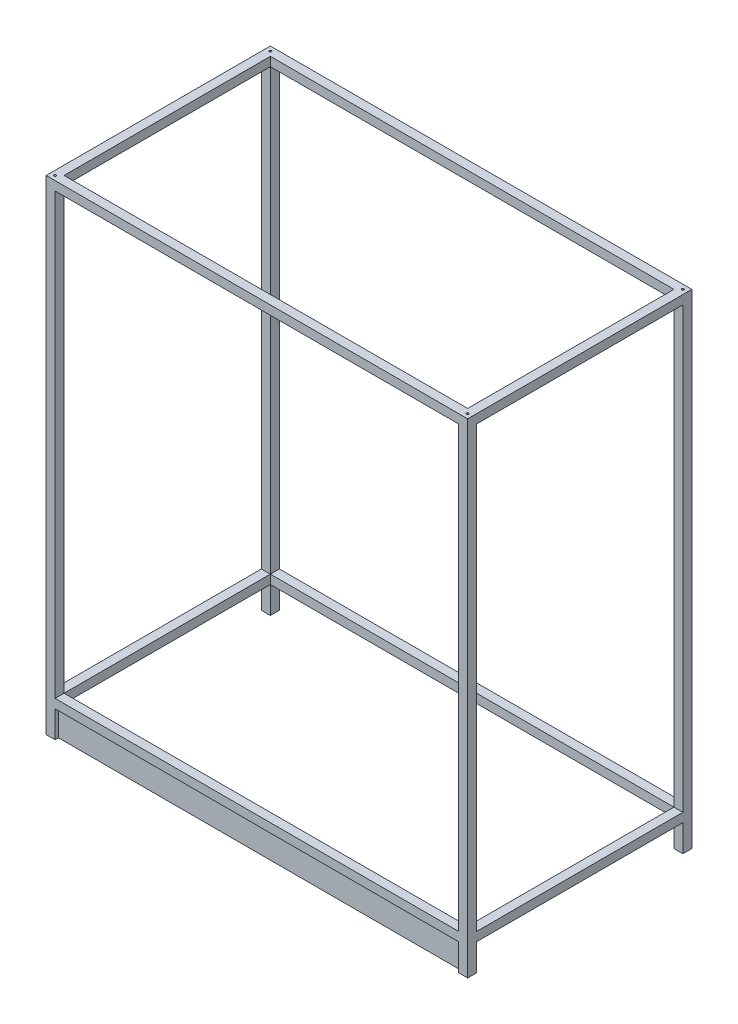
from build123d import *

# Parameters (mm, degrees)
SKETCH1_W       = 1193.8
SKETCH1_H       = 1371.6
EXTRUDE1_DEPTH  = 635
EXTRUDE4_DEPTH  = 1270
SKETCH6_W       = 25.4
SKETCH6_H       = 25.4
EXTRUDE5_DEPTH  = 584.2
SKETCH8_W       = 25.4
SKETCH8_H       = 25.4
EXTRUDE6_DEPTH  = 1143
SKETCH9_W       = 25.4
SKETCH9_H       = 25.4
EXTRUDE7_DEPTH  = 584.2
SKETCH10_W      = 25.4
SKETCH10_H      = 25.4
EXTRUDE8_DEPTH  = 1143
SHELL2_T        = -25.4
SKETCH17_R      = 3.175
EXTRUDE14_DEPTH = 1927.050362789
SKETCH24_W      = 1143
SKETCH24_H      = 584.2
EXTRUDE15_DEPTH = 25.4
SKETCH12_W      = 1143
SKETCH12_H      = 76.2
EXTRUDE16_DEPTH = 38.1
SKETCH13_W      = 584.2
SKETCH13_H      = 76.2
EXTRUDE17_DEPTH = 38.1
SKETCH14_W      = 1143
SKETCH14_H      = 76.2
EXTRUDE18_DEPTH = 38.1
SKETCH11_W      = 584.2
SKETCH11_H      = 76.2
EXTRUDE19_DEPTH = 38.1
SKETCH30_W      = 1143
SKETCH30_H      = 5.614753794
EXTRUDE20_DEPTH = 76.2


with BuildPart() as part:
    # Sketch1 → Extrude1 (new body)
    with BuildSketch(Plane.XY):
        with Locations((596.9, 685.8)):
            Rectangle(SKETCH1_W, SKETCH1_H)
    extrude(amount=EXTRUDE1_DEPTH)

    # Sketch2 → Extrude4 (cut)
    with BuildSketch(Plane(origin=(0, 1371.6, 0), x_dir=(1, 0, 0), z_dir=(0, 1, 0))):
        Polygon((25.4, -609.6), (25.4, -635), (1168.4, -635), (1168.4, -609.6), (1193.8, -609.6), (1193.8, -25.4), (1168.4, -25.4), (1168.4, 0), (25.4, 0), (25.4, -25.4), (0, -25.4), (0, -609.6), align=None)
    extrude(amount=-EXTRUDE4_DEPTH, mode=Mode.SUBTRACT)

    # Sketch6 → Extrude5 (add)
    with BuildSketch(Plane.XY.offset(25.4)):
        with Locations((12.7, 1358.9)):
            Rectangle(SKETCH6_W, SKETCH6_H)
    extrude(amount=EXTRUDE5_DEPTH)

    # Sketch8 → Extrude6 (add)
    with BuildSketch(Plane(origin=(25.4, 0, 0), x_dir=(0, 0, -1), z_dir=(1, 0, 0))):
        with Locations((-622.3, 1358.9)):
            Rectangle(SKETCH8_W, SKETCH8_H)
    extrude(amount=EXTRUDE6_DEPTH)

    # Sketch9 → Extrude7 (add)
    with BuildSketch(Plane(origin=(0, 0, 609.6), x_dir=(-1, 0, 0), z_dir=(0, 0, -1))):
        with Locations((-1181.1, 1358.9)):
            Rectangle(SKETCH9_W, SKETCH9_H)
    extrude(amount=EXTRUDE7_DEPTH)

    # Sketch10 → Extrude8 (add)
    with BuildSketch(Plane.ZY.offset(-1168.4)):
        with Locations((12.7, 1358.9)):
            Rectangle(SKETCH10_W, SKETCH10_H)
    extrude(amount=EXTRUDE8_DEPTH)

    # Shell2
    shell2_openings = [part.faces().sort_by_distance(p)[0] for p in [
        (596.9, 0, 317.5),
    ]]
    offset(amount=SHELL2_T, openings=shell2_openings)

    # Sketch17 → Extrude14 (cut, through all)
    with BuildSketch(Plane(origin=(0, 1371.6, 0), x_dir=(1, 0, 0), z_dir=(0, 1, 0))):
        with Locations(Location((1181.1, -622.3, 0), (0, 0, 270))):
            Circle(SKETCH17_R)
        with Locations(Location((1181.1, -12.7, 0), (0, 0, 270))):
            Circle(SKETCH17_R)
        with Locations(Location((12.7, -12.7, 0), (0, 0, 270))):
            Circle(SKETCH17_R)
        with Locations(Location((12.7, -622.3, 0), (0, 0, 270))):
            Circle(SKETCH17_R)
    extrude(amount=-EXTRUDE14_DEPTH, mode=Mode.SUBTRACT)

    # Sketch24 → Extrude15 (cut)
    with BuildSketch(Plane(origin=(0, 101.6, 0), x_dir=(1, 0, 0), z_dir=(0, 1, 0))):
        with Locations((596.9, -317.5)):
            Rectangle(SKETCH24_W, SKETCH24_H)
    extrude(amount=-EXTRUDE15_DEPTH, mode=Mode.SUBTRACT)

    # Sketch12 → Extrude16 (cut)
    with BuildSketch(Plane.XY.offset(25.4)):
        with Locations((596.9, 38.1)):
            Rectangle(SKETCH12_W, SKETCH12_H)
    extrude(amount=-EXTRUDE16_DEPTH, mode=Mode.SUBTRACT)

    # Sketch13 → Extrude17 (cut)
    with BuildSketch(Plane.ZY.offset(-1168.4)):
        with Locations((317.5, 38.1)):
            Rectangle(SKETCH13_W, SKETCH13_H)
    extrude(amount=-EXTRUDE17_DEPTH, mode=Mode.SUBTRACT)

    # Sketch14 → Extrude18 (cut)
    with BuildSketch(Plane(origin=(0, 0, 609.6), x_dir=(-1, 0, 0), z_dir=(0, 0, -1))):
        with Locations((-596.9, 38.1)):
            Rectangle(SKETCH14_W, SKETCH14_H)
    extrude(amount=-EXTRUDE18_DEPTH, mode=Mode.SUBTRACT)

    # Sketch11 → Extrude19 (cut)
    with BuildSketch(Plane(origin=(25.4, 0, 0), x_dir=(0, 0, -1), z_dir=(1, 0, 0))):
        with Locations((-317.5, 38.1)):
            Rectangle(SKETCH11_W, SKETCH11_H)
    extrude(amount=-EXTRUDE19_DEPTH, mode=Mode.SUBTRACT)

    # Sketch30 → Extrude20 (add)
    with BuildSketch(Plane.XZ.offset(-76.2)):
        with Locations((596.9, 622.563749497)):
            Rectangle(SKETCH30_W, SKETCH30_H)
    extrude(amount=EXTRUDE20_DEPTH)


solid = part.part
